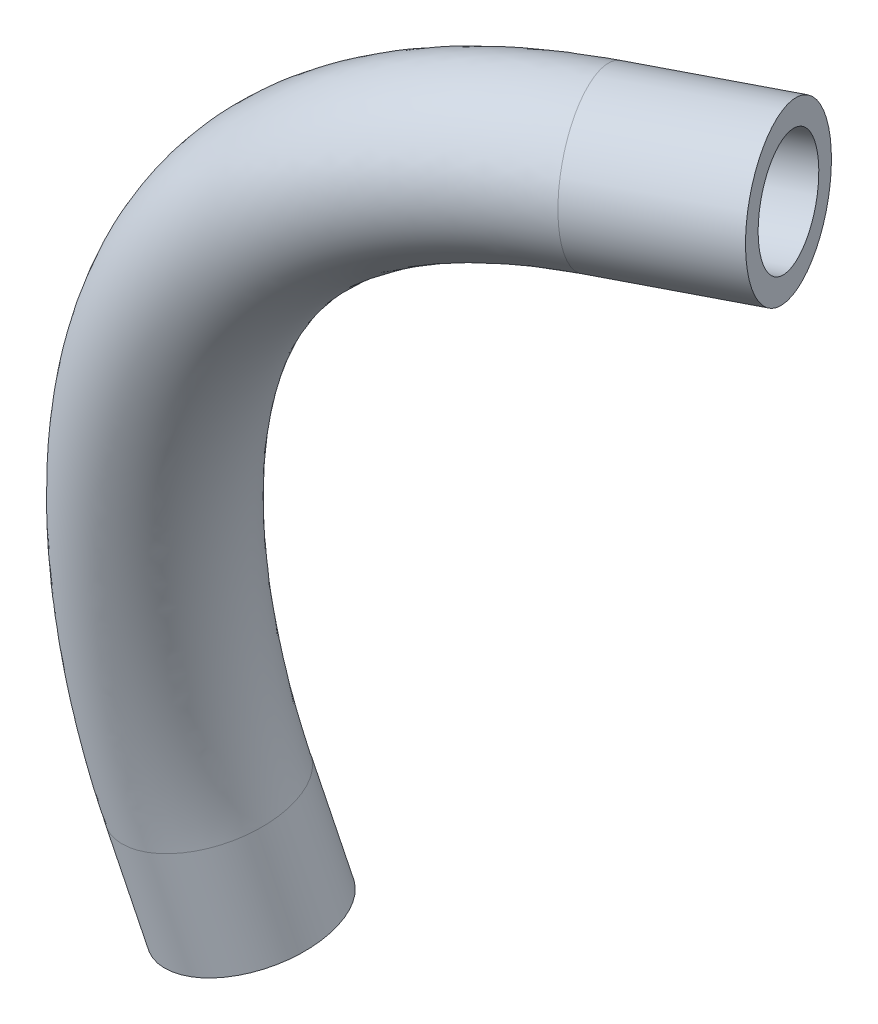
from build123d import *

# Parameters (mm, degrees)
SWEEP1_PROFILE_R     = 13.49375
CUT_SWEEP1_PROFILE_R = 9.525


with BuildPart() as part:
    # Sweep1: sweep along a curve in space
    with BuildLine() as sweep1_path:
        Line((1.507056985, -46.735868675, -12.121766428), (-2.89884077, -28.462007596, -9.030396792))
        add(Edge.make_bspline(
            [(-2.89884077, -28.462007596, -9.030396792), (-12.733389263, 12.327675443, -2.130049512), (3.694377524, 97.398918076, 17.871222686), (67.313961037, 102.150301712, -7.831655808)],
            knots=[0, 0, 0, 0, 1, 1, 1, 1], degree=3))
        Line((67.313961037, 102.150301712, -7.831655808), (90.808311358, 103.904960663, -17.323582638))
    # Sweep1 profile (on start of the path) → Sweep1 (sweep)
    with BuildSketch(Plane(origin=(1.507056985, -46.735868675, -12.121766428), x_dir=(0.9721432612515077, 0.23438745615600456, 0), z_dir=(-0.23128072205980613, 0.959257799436907, 0.16227662130743767))):
        Circle(SWEEP1_PROFILE_R)
    sweep(path=sweep1_path.line, is_frenet=True)

    # Cut-Sweep1: sweep along a curve in space
    with BuildLine() as cut_sweep1_path:
        Line((1.507056985, -46.735868675, -12.121766428), (-2.89884077, -28.462007596, -9.030396792))
        add(Edge.make_bspline(
            [(-2.89884077, -28.462007596, -9.030396792), (-12.733389263, 12.327675443, -2.130049512), (3.694377524, 97.398918076, 17.871222686), (67.313961037, 102.150301712, -7.831655808)],
            knots=[0, 0, 0, 0, 1, 1, 1, 1], degree=3))
        Line((67.313961037, 102.150301712, -7.831655808), (90.808311358, 103.904960663, -17.323582638))
    # Cut-Sweep1 profile (on start of the path) → Cut-Sweep1 (sweep, cut)
    with BuildSketch(Plane(origin=(1.507056985, -46.735868675, -12.121766428), x_dir=(0.9721432612515077, 0.23438745615600456, 0), z_dir=(-0.23128072205980613, 0.959257799436907, 0.16227662130743767))):
        Circle(CUT_SWEEP1_PROFILE_R)
    sweep(path=cut_sweep1_path.line, mode=Mode.SUBTRACT)


solid = part.part
